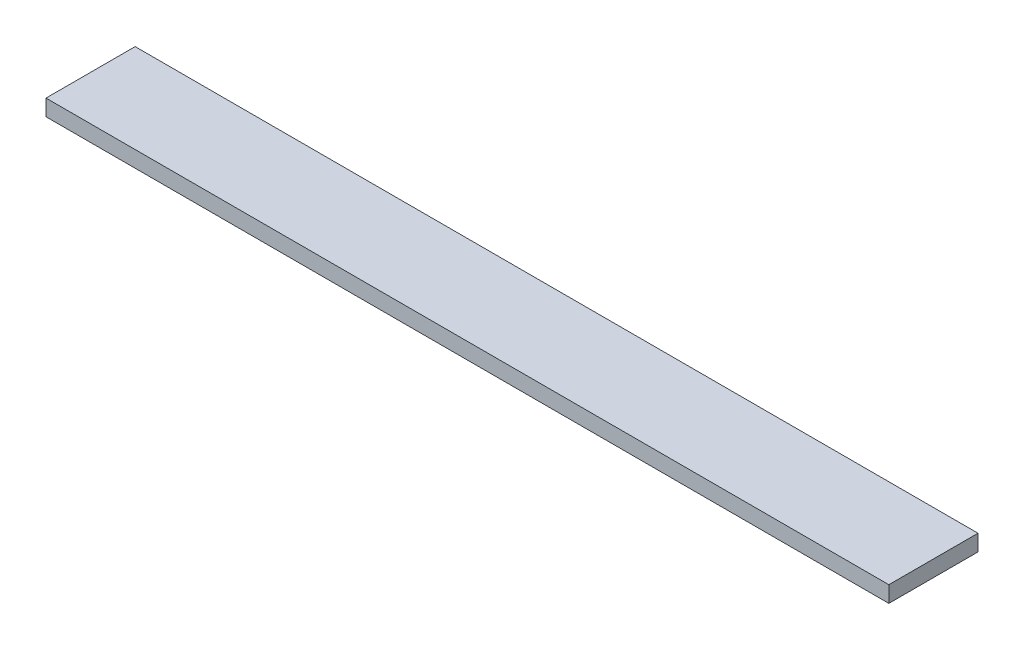
from build123d import *

# Parameters (mm, degrees)
SKETCH1_W           = 52
SKETCH1_H           = 5.5
BOSS_EXTRUDE1_DEPTH = 1


with BuildPart() as part:
    # Sketch1 → Boss-Extrude1 (new body)
    with BuildSketch(Plane(origin=(0, 0, 0), x_dir=(1, 0, 0), z_dir=(0, 1, 0))):
        Rectangle(SKETCH1_W, SKETCH1_H)
    extrude(amount=BOSS_EXTRUDE1_DEPTH)


solid = part.part
